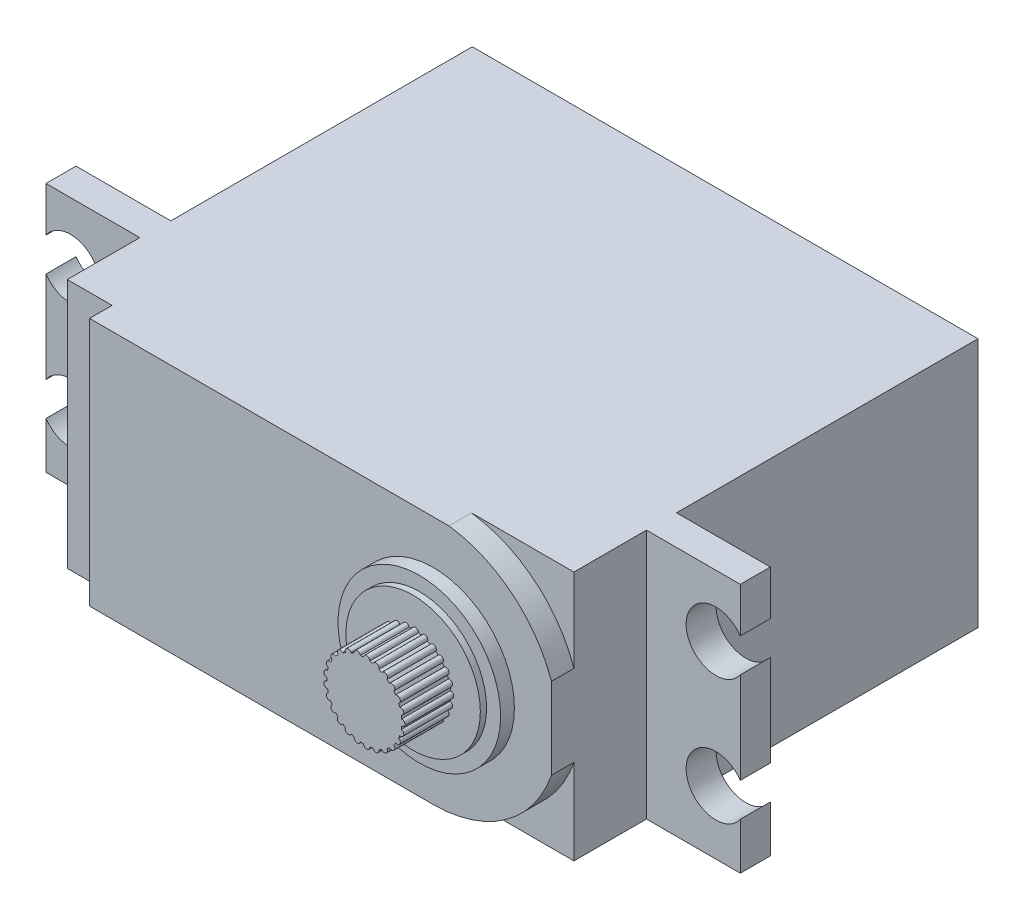
from build123d import *

# Parameters (mm, degrees)
AUFSATZ_LINEAR_AUSTRAGEN1_DEPTH = 2.4
SKIZZE3_W                       = 40.5
SKIZZE3_H                       = 20
AUFSATZ_LINEAR_AUSTRAGEN2_DEPTH = 5.8
AUFSATZ_LINEAR_AUSTRAGEN3_DEPTH = 1.8
SKIZZE5_R                       = 6.5
AUFSATZ_LINEAR_AUSTRAGEN4_DEPTH = 1.1
SKIZZE7_R                       = 5.375
AUFSATZ_LINEAR_AUSTRAGEN6_DEPTH = 0.5
AUFSATZ_LINEAR_AUSTRAGEN7_DEPTH = 3.9
SKIZZE9_W                       = 40.423818814
SKIZZE9_H                       = 24.1
AUFSATZ_LINEAR_AUSTRAGEN8_DEPTH = 20


with BuildPart() as part:
    # Skizze1 → Aufsatz-Linear austragen1 (new body)
    with BuildSketch(Plane.XY):
        with BuildLine():
            Line((0, 0), (55.5, 0))
            Line((55.5, 0), (55.5, -3.573452275))
            ThreePointArc((55.5, -3.573452275), (51.16844052, -4.919743477), (55.5, -6.266034679))
            Line((55.5, -6.266034679), (55.5, -13.573452275))
            ThreePointArc((55.5, -13.573452275), (51.16844052, -14.919743477), (55.5, -16.266034679))
            Line((55.5, -16.266034679), (55.5, -20))
            Line((55.5, -20), (0, -20))
            Line((0, -20), (0, -16.266034679))
            ThreePointArc((0, -16.266034679), (4.33155948, -14.919743477), (0, -13.573452275))
            Line((0, -13.573452275), (0, -6.266034679))
            ThreePointArc((0, -6.266034679), (4.33155948, -4.919743477), (0, -3.573452275))
            Line((0, -3.573452275), (0, 0))
        make_face()
    extrude(amount=AUFSATZ_LINEAR_AUSTRAGEN1_DEPTH)

    # Skizze3 → Aufsatz-Linear austragen2 (add)
    with BuildSketch(Plane.XY.offset(2.4)):
        with Locations((27.75, -10)):
            Rectangle(SKIZZE3_W, SKIZZE3_H)
    extrude(amount=AUFSATZ_LINEAR_AUSTRAGEN2_DEPTH)

    # Skizze4 → Aufsatz-Linear austragen3 (add)
    with BuildSketch(Plane.XY.offset(8.2)):
        with BuildLine():
            Line((37.279047641, 0), (11.081933488, 0))
            Line((11.081933488, 0), (11.081933488, -19.919743477))
            Line((11.081933488, -19.919743477), (38.54344052, -19.919743477))
            ThreePointArc((38.54344052, -19.919743477), (44.352188568, -18.059672599), (48, -13.171432699))
            Line((48, -13.171432699), (48, -6.668054255))
            ThreePointArc((48, -6.668054255), (44.85616115, -2.16412885), (39.807833399, 0))
            Line((39.807833399, 0), (38.54344052, 0))
            Line((38.54344052, 0), (37.279047641, 0))
        make_face()
    extrude(amount=AUFSATZ_LINEAR_AUSTRAGEN3_DEPTH)

    # Skizze5 → Aufsatz-Linear austragen4 (add)
    with BuildSketch(Plane.XY.offset(10)):
        with Locations((38.54344052, -10)):
            Circle(SKIZZE5_R)
    extrude(amount=AUFSATZ_LINEAR_AUSTRAGEN4_DEPTH)

    # Skizze7 → Aufsatz-Linear austragen6 (add)
    with BuildSketch(Plane.XY.offset(11.1)):
        with Locations((38.54344052, -10)):
            Circle(SKIZZE7_R)
    extrude(amount=AUFSATZ_LINEAR_AUSTRAGEN6_DEPTH)

    # Skizze8 → Aufsatz-Linear austragen7 (add)
    with BuildSketch(Plane.XY.offset(11.6)):
        with BuildLine():
            ThreePointArc((41.283566191, -11.221356338), (41.332769977, -11.104373658), (41.376982116, -10.985414645))
            ThreePointArc((41.376982116, -10.985414645), (41.691335793, -10.808242133), (41.501219074, -10.501543639))
            ThreePointArc((41.501219074, -10.501543639), (41.519784624, -10.375999701), (41.533023853, -10.249782892))
            ThreePointArc((41.533023853, -10.249782892), (41.79344052, -10), (41.533023853, -9.750217108))
            ThreePointArc((41.533023853, -9.750217108), (41.519784624, -9.624000299), (41.501219074, -9.498456361))
            ThreePointArc((41.501219074, -9.498456361), (41.691335793, -9.191757867), (41.376982116, -9.014585355))
            ThreePointArc((41.376982116, -9.014585355), (41.332769977, -8.895626342), (41.283566191, -8.778643662))
            ThreePointArc((41.283566191, -8.778643662), (41.39143723, -8.434300559), (41.042898539, -8.340870828))
            ThreePointArc((41.042898539, -8.340870828), (40.970491503, -8.236644243), (40.893741134, -8.135573273))
            ThreePointArc((40.893741134, -8.135573273), (40.912588559, -7.775221906), (40.551764823, -7.771405489))
            ThreePointArc((40.551764823, -7.771405489), (40.455712489, -7.688460272), (40.356238046, -7.609651672))
            ThreePointArc((40.356238046, -7.609651672), (40.284877603, -7.255934242), (39.934440705, -7.34197094))
            ThreePointArc((39.934440705, -7.34197094), (39.820778394, -7.285518843), (39.704830223, -7.233924448))
            ThreePointArc((39.704830223, -7.233924448), (39.547745751, -6.909066322), (39.229714929, -7.079550131))
            ThreePointArc((39.229714929, -7.079550131), (39.105584463, -7.053138248), (38.980448013, -7.031999924))
            ThreePointArc((38.980448013, -7.031999924), (38.747509708, -6.756413133), (38.481868008, -7.000631929))
            ThreePointArc((38.481868008, -7.000631929), (38.355068961, -7.005919815), (38.228607015, -7.01656576))
            ThreePointArc((38.228607015, -7.01656576), (37.934451247, -6.807566435), (37.737889915, -7.110175053))
            ThreePointArc((37.737889915, -7.110175053), (37.616389537, -7.146830451), (37.496548164, -7.188591742))
            ThreePointArc((37.496548164, -7.188591742), (37.159657822, -7.059312079), (37.044527528, -7.401296507))
            ThreePointArc((37.044527528, -7.401296507), (36.935960135, -7.467016223), (36.83026941, -7.537268844))
            ThreePointArc((36.83026941, -7.537268844), (36.471812553, -7.495831961), (36.445347358, -7.855704059))
            ThreePointArc((36.445347358, -7.855704059), (36.356534637, -7.946358682), (36.271635497, -8.040688402))
            ThreePointArc((36.271635497, -8.040688402), (35.914135288, -8.08969793), (35.977998097, -8.444845611))
            ThreePointArc((35.977998097, -8.444845611), (35.91452048, -8.554738978), (35.855747449, -8.667218713))
            ThreePointArc((35.855747449, -8.667218713), (35.521666941, -8.803595204), (35.671845018, -9.131703232))
            ThreePointArc((35.671845018, -9.131703232), (35.637691036, -9.253930339), (35.608737041, -9.377492575))
            ThreePointArc((35.608737041, -9.377492575), (35.31906774, -9.592666991), (35.546124846, -9.873119133))
            ThreePointArc((35.546124846, -9.873119133), (35.54344052, -10), (35.546124846, -10.126880867))
            ThreePointArc((35.546124846, -10.126880867), (35.31906774, -10.407333009), (35.608737041, -10.622507425))
            ThreePointArc((35.608737041, -10.622507425), (35.637691036, -10.746069661), (35.671845018, -10.868296768))
            ThreePointArc((35.671845018, -10.868296768), (35.521666941, -11.196404796), (35.855747449, -11.332781287))
            ThreePointArc((35.855747449, -11.332781287), (35.91452048, -11.445261022), (35.977998097, -11.555154389))
            ThreePointArc((35.977998097, -11.555154389), (35.914135288, -11.91030207), (36.271635497, -11.959311598))
            ThreePointArc((36.271635497, -11.959311598), (36.356534637, -12.053641318), (36.445347358, -12.144295941))
            ThreePointArc((36.445347358, -12.144295941), (36.471812553, -12.504168039), (36.83026941, -12.462731156))
            ThreePointArc((36.83026941, -12.462731156), (36.935960135, -12.532983777), (37.044527528, -12.598703493))
            ThreePointArc((37.044527528, -12.598703493), (37.159657822, -12.940687921), (37.496548164, -12.811408258))
            ThreePointArc((37.496548164, -12.811408258), (37.616389537, -12.853169549), (37.737889915, -12.889824947))
            ThreePointArc((37.737889915, -12.889824947), (37.934451247, -13.192433565), (38.228607015, -12.98343424))
            ThreePointArc((38.228607015, -12.98343424), (38.355068961, -12.994080185), (38.481868008, -12.999368071))
            ThreePointArc((38.481868008, -12.999368071), (38.747509708, -13.243586867), (38.980448013, -12.968000076))
            ThreePointArc((38.980448013, -12.968000076), (39.105584463, -12.946861752), (39.229714929, -12.920449869))
            ThreePointArc((39.229714929, -12.920449869), (39.547745751, -13.090933678), (39.704830223, -12.766075552))
            ThreePointArc((39.704830223, -12.766075552), (39.820778394, -12.714481157), (39.934440705, -12.65802906))
            ThreePointArc((39.934440705, -12.65802906), (40.284877603, -12.744065758), (40.356238046, -12.390348328))
            ThreePointArc((40.356238046, -12.390348328), (40.455712489, -12.311539728), (40.551764823, -12.228594511))
            ThreePointArc((40.551764823, -12.228594511), (40.912588559, -12.224778094), (40.893741134, -11.864426727))
            ThreePointArc((40.893741134, -11.864426727), (40.970491503, -11.763355757), (41.042898539, -11.659129172))
            ThreePointArc((41.042898539, -11.659129172), (41.39143723, -11.565699441), (41.283566191, -11.221356338))
        make_face()
    extrude(amount=AUFSATZ_LINEAR_AUSTRAGEN7_DEPTH)

    # Skizze9 → Aufsatz-Linear austragen8 (add)
    with BuildSketch(Plane(origin=(0, 0, 0), x_dir=(1, 0, 0), z_dir=(0, 1, 0))):
        with Locations((27.788090593, 12.05)):
            Rectangle(SKIZZE9_W, SKIZZE9_H)
    extrude(amount=-AUFSATZ_LINEAR_AUSTRAGEN8_DEPTH)


solid = part.part
